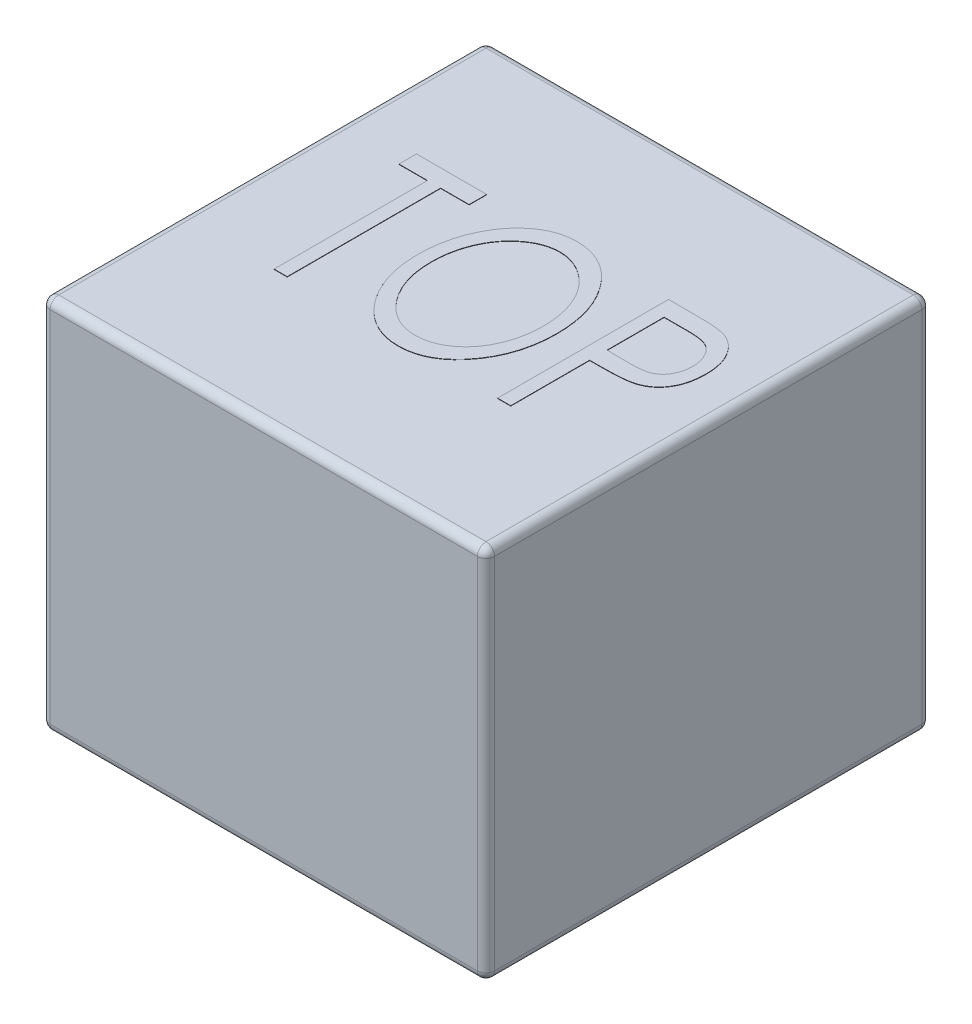
from build123d import *

# Parameters (mm, degrees)
SKETCH1_W           = 330.2
SKETCH1_H           = 330.2
BOSS_EXTRUDE1_DEPTH = 139.7
FILLET1_R           = 6.35
SHELL1_T            = 2.54
BOSS_EXTRUDE2_DEPTH = 0.254


with BuildPart() as part:
    # Sketch1 → Boss-Extrude1 (new, symmetric)
    with BuildSketch(Plane(origin=(0, 0, 0), x_dir=(1, 0, 0), z_dir=(0, 1, 0))):
        Rectangle(SKETCH1_W, SKETCH1_H)
    extrude(amount=BOSS_EXTRUDE1_DEPTH, both=True)

    # Fillet1
    fillet1_edges = [part.edges().sort_by_distance(p)[0] for p in [
        (-165.1, 139.7, 0),
        (0, 139.7, 165.1),
        (165.1, 139.7, 0),
        (0, -139.7, 165.1),
        (-165.1, -139.7, 0),
        (0, -139.7, -165.1),
        (165.1, -139.7, 0),
        (0, 139.7, -165.1),
        (165.1, 0, 165.1),
        (-165.1, 0, 165.1),
        (-165.1, 0, -165.1),
        (165.1, 0, -165.1),
    ]]
    fillet(fillet1_edges, radius=FILLET1_R)

    # Shell1 (no face opened: a closed hollow body)
    add(offset(amount=-SHELL1_T, mode=Mode.PRIVATE), mode=Mode.SUBTRACT)

    # Sketch2 → Boss-Extrude2 (add)
    # profile 1 of 3: a face of its own
    with BuildSketch(Plane(origin=(0, 139.7, 0), x_dir=(1, 0, 0), z_dir=(0, 1, 0))):
        Polygon((-116.257747145, 51.608887449), (-116.257747145, 64.634528475), (-64.155183043, 64.634528475), (-64.155183043, 51.608887449), (-85.321849709, 51.608887449), (-85.321849709, -62.365471525), (-95.091080479, -62.365471525), (-95.091080479, 51.608887449), align=None)
    # profile 2 of 3: a face of its own
    with BuildSketch(Plane(origin=(0, 139.7, 0), x_dir=(1, 0, 0), z_dir=(0, 1, 0))):
        with BuildLine():
            add(Edge.make_bspline(
                [(-0.477098107, 67.890938731), (1.332510055, 67.831001939), (4.897803281, 67.712914366), (10.136290395, 66.814017504), (15.124267645, 65.252329908), (19.928231303, 63.184557967), (24.449626918, 60.404111996), (28.778353935, 57.093301664), (32.833628821, 53.120957478), (36.63736966, 48.630165299), (40.08915671, 43.700269005), (43.145834194, 38.457373487), (45.705701534, 32.923156609), (47.838427264, 27.117699207), (49.460436839, 21.026900279), (50.585727835, 14.650859003), (51.32989139, 8.012630984), (51.407796821, 3.485615096), (51.44738106, 1.185409885)],
                knots=[0, 0, 0, 0, 0.924077672, 1.820619477, 2.704345957, 3.588793985, 4.484676341, 5.408225969, 6.367020371, 7.378085712, 8.410352545, 9.437079119, 10.473843711, 11.520765135, 12.592473861, 13.688494999, 14.825509789, 16, 16, 16, 16], degree=3))
            add(Edge.make_bspline(
                [(51.44738106, 1.185409885), (51.407954053, -1.097878767), (51.330365892, -5.591148362), (50.583237504, -12.186533678), (49.461812507, -18.529522501), (47.829989025, -24.608594101), (45.70796732, -30.413361342), (43.162251361, -35.974454308), (40.123400758, -41.249662075), (36.660075969, -46.197949702), (32.889947195, -50.728567364), (28.848577637, -54.697801904), (24.625210828, -58.095245156), (20.153306075, -60.831347903), (15.503557703, -63.008113829), (10.619014647, -64.494563567), (5.547651853, -65.455003315), (2.088323871, -65.565793262), (0.337004457, -65.621881782)],
                knots=[0, 0, 0, 0, 1.174734241, 2.311752237, 3.411847821, 4.48752463, 5.546540565, 6.589387645, 7.631512928, 8.675236458, 9.694545695, 10.660582558, 11.586248185, 12.47779178, 13.352673572, 14.221009544, 15.099368277, 16, 16, 16, 16], degree=3))
            add(Edge.make_bspline(
                [(0.337004457, -65.621881782), (-1.439783997, -65.566396642), (-4.941332781, -65.457051086), (-10.079102678, -64.491262776), (-15.012622144, -63.013653866), (-19.719173109, -60.856361968), (-24.217305685, -58.125216581), (-28.488841703, -54.752412203), (-32.535681302, -50.779442163), (-36.345805605, -46.285129032), (-39.795197951, -41.3541881), (-42.853127874, -36.12418546), (-45.377521475, -30.603796006), (-47.513881659, -24.864916686), (-49.14367975, -18.860756623), (-50.263437944, -12.602283923), (-51.012921852, -6.100278698), (-51.090242755, -1.674580458), (-51.129542017, 0.574832962)],
                knots=[0, 0, 0, 0, 0.916029328, 1.805235379, 2.688326709, 3.567593798, 4.468872984, 5.39761654, 6.369240692, 7.39061962, 8.433416311, 9.470616228, 10.512145238, 11.561531085, 12.627274475, 13.717256431, 14.839768611, 16, 16, 16, 16], degree=3))
            add(Edge.make_bspline(
                [(-51.129542017, 0.574832962), (-51.112594533, 2.084976877), (-51.078943502, 5.08352798), (-50.729638223, 9.540114978), (-50.201300449, 13.921247255), (-49.46309512, 18.217560919), (-48.527482157, 22.433540585), (-47.344863507, 26.555174764), (-45.985485953, 30.606514692), (-44.370640875, 34.536371478), (-42.616555322, 38.333944482), (-40.666255677, 41.922724883), (-38.622579881, 45.327461103), (-36.367006495, 48.484036352), (-33.975847521, 51.445253654), (-31.424729083, 54.197460015), (-28.732508159, 56.752129764), (-25.877474914, 59.052921019), (-22.949870851, 61.153331474), (-19.901899605, 62.923332923), (-16.81931378, 64.472259492), (-13.658498049, 65.714998623), (-10.443182, 66.692354686), (-7.172238037, 67.36634087), (-3.848739189, 67.833682212), (-1.606599712, 67.871757766), (-0.477098107, 67.890938731)],
                knots=[0, 0, 0, 0, 1.165548892, 2.314321092, 3.448658809, 4.571166437, 5.678142732, 6.780580233, 7.879845021, 8.975145667, 10.058763506, 11.107348894, 12.126777312, 13.122170764, 14.099577622, 15.063118597, 16.017094101, 16.961792914, 17.891746868, 18.795549715, 19.679698158, 20.552529034, 21.414067769, 22.270442689, 23.128717112, 24, 24, 24, 24], degree=3))
        make_face()
        with BuildLine():
            add(Edge.make_bspline(
                [(-0.04460612, 54.865297705), (-0.944875395, 54.850426102), (-2.74417294, 54.820703395), (-5.421110229, 54.433339757), (-8.070043085, 53.885959786), (-10.68192885, 53.100145723), (-13.232909748, 52.026384804), (-15.779487025, 50.795609956), (-18.278279844, 49.310548983), (-20.705445476, 47.602311557), (-23.073971928, 45.733003247), (-25.306567069, 43.663362962), (-27.425113092, 41.4552666), (-29.385586858, 39.074237496), (-31.220553747, 36.550958701), (-32.932164472, 33.868562799), (-34.507700795, 31.023945604), (-35.921345116, 28.027343499), (-37.194408463, 24.919123721), (-38.319360269, 21.712847737), (-39.25786253, 18.407024955), (-40.013301918, 15.015364183), (-40.635149249, 11.545794), (-41.059244738, 7.98666783), (-41.32370388, 4.335659268), (-41.348006092, 1.872770695), (-41.360311248, 0.625714372)],
                knots=[0, 0, 0, 0, 0.858142747, 1.715102558, 2.575073736, 3.437514735, 4.31186347, 5.212756088, 6.134013882, 7.081088492, 8.042565498, 9.010149336, 9.982893837, 10.959666839, 11.949981133, 12.957623844, 13.993261068, 15.049918441, 16.11656253, 17.196257349, 18.289715237, 19.392708064, 20.509938589, 21.650847962, 22.81053291, 24, 24, 24, 24], degree=3))
            add(Edge.make_bspline(
                [(-41.360311248, 0.625714372), (-41.332327635, -1.20782087), (-41.277375516, -4.808379655), (-40.661048314, -10.087092383), (-39.735705302, -15.152116147), (-38.406733447, -20.003121773), (-36.706868127, -24.647013292), (-34.60718036, -29.058736289), (-32.157445564, -33.268100739), (-29.327462934, -37.187816053), (-26.256721189, -40.781463974), (-22.990626338, -43.944440145), (-19.546012412, -46.599035546), (-15.949252574, -48.790605417), (-12.206182334, -50.513668405), (-8.284952554, -51.704086911), (-4.22242131, -52.482669997), (-1.447461601, -52.558105187), (-0.04460612, -52.596240756)],
                knots=[0, 0, 0, 0, 1.177444537, 2.312177139, 3.40960841, 4.482848825, 5.539490554, 6.582560744, 7.617904436, 8.664199621, 9.684176649, 10.651348494, 11.579811393, 12.472147848, 13.352309381, 14.219132689, 15.099698832, 16, 16, 16, 16], degree=3))
            add(Edge.make_bspline(
                [(-0.04460612, -52.596240756), (0.897689816, -52.578799709), (2.771256709, -52.544121678), (5.554015987, -52.200160879), (8.286516952, -51.643787722), (10.961787785, -50.844822853), (13.582707322, -49.855153064), (16.157983134, -48.650089004), (18.658952711, -47.198004143), (21.108488202, -45.541664529), (23.456224393, -43.689121079), (25.709838398, -41.684774816), (27.791213421, -39.481444), (29.755176793, -37.137613211), (31.595197326, -34.633906616), (33.297375664, -31.966741106), (34.852092016, -29.124159188), (36.272505494, -26.13465009), (37.528995589, -23.01149637), (38.669406118, -19.812666491), (39.561026004, -16.503296308), (40.375809522, -13.1353221), (40.938646844, -9.662809361), (41.382286755, -6.11704209), (41.639748187, -2.481915415), (41.665270753, -0.027652375), (41.678150291, 1.21085059)],
                knots=[0, 0, 0, 0, 0.896597927, 1.782705547, 2.664500824, 3.548252163, 4.437296353, 5.329230919, 6.25137377, 7.187229144, 8.141596259, 9.096202311, 10.055404798, 11.023835637, 12.00546529, 13.01090224, 14.033305449, 15.087649765, 16.159432575, 17.236763908, 18.317868849, 19.42025149, 20.533661908, 21.664060857, 22.821207218, 24, 24, 24, 24], degree=3))
            add(Edge.make_bspline(
                [(41.678150291, 1.21085059), (41.665260953, 2.440873428), (41.639720399, 4.878195233), (41.382443897, 8.487961243), (40.938185663, 12.008160519), (40.378878502, 15.44767056), (39.560840654, 18.772582606), (38.669263682, 22.031324831), (37.529131479, 25.179357133), (36.271409471, 28.251110471), (34.850728938, 31.202939512), (33.26895972, 34.001073004), (31.563176967, 36.652564311), (29.729713064, 39.159013382), (27.740597452, 41.505811948), (25.599739604, 43.691441313), (23.331561765, 45.731683681), (20.945058427, 47.612323099), (18.471480714, 49.30303869), (15.944838693, 50.796434779), (13.366214132, 52.032268507), (10.769855592, 53.100316607), (8.115230495, 53.882243967), (5.425518978, 54.436552749), (2.705531067, 54.820215288), (0.872564681, 54.850262718), (-0.04460612, 54.865297705)],
                knots=[0, 0, 0, 0, 1.175746054, 2.329770965, 3.456974185, 4.567169911, 5.658498816, 6.728634852, 7.795295362, 8.856674807, 9.90091875, 10.924568154, 11.927495013, 12.913337012, 13.891146488, 14.865724416, 15.835875264, 16.80572122, 17.768118354, 18.69828985, 19.608354684, 20.499556212, 21.3793278, 22.249031646, 23.123858975, 24, 24, 24, 24], degree=3))
        make_face(mode=Mode.SUBTRACT)
    # profile 3 of 3: a face of its own
    with BuildSketch(Plane(origin=(0, 139.7, 0), x_dir=(1, 0, 0), z_dir=(0, 1, 0))):
        with BuildLine():
            Line((70.985842598, 64.634528475), (90.702389073, 64.634528475))
            add(Edge.make_bspline(
                [(90.702389073, 64.634528475), (92.059321082, 64.632692833), (94.654893975, 64.629181572), (98.378054752, 64.519480217), (101.762619585, 64.373027201), (104.799260681, 64.171530278), (107.492217004, 63.932586473), (109.831683061, 63.592176416), (111.847055149, 63.245545821), (113.050200832, 62.889079884), (113.599023688, 62.72647559)],
                knots=[0, 0, 0, 0, 1.413289242, 2.703374391, 3.879342949, 4.941642004, 5.873291596, 6.693989754, 7.404254793, 8, 8, 8, 8], degree=3))
            add(Edge.make_bspline(
                [(113.599023688, 62.72647559), (114.300293426, 62.486721919), (115.687676063, 62.012396475), (117.6628722, 61.043861239), (119.549530649, 59.929945598), (121.338294313, 58.625739431), (123.021113822, 57.133316591), (124.630947308, 55.490551173), (126.103377585, 53.632170058), (127.502114126, 51.635249908), (128.772505526, 49.480529825), (129.877259585, 47.176124135), (130.773525562, 44.732394011), (131.561205975, 42.165051992), (132.121255706, 39.453625916), (132.565883992, 36.61100702), (132.820375971, 33.635486561), (132.845058568, 31.604479153), (132.85763747, 30.569424308)],
                knots=[0, 0, 0, 0, 0.884746594, 1.750370786, 2.622729615, 3.500310264, 4.390609716, 5.30783377, 6.244661446, 7.220040901, 8.219286538, 9.229974682, 10.268866035, 11.326756505, 12.435726026, 13.573575987, 14.763430443, 16, 16, 16, 16], degree=3))
            add(Edge.make_bspline(
                [(132.85763747, 30.569424308), (132.846407721, 29.525698835), (132.824460258, 27.48583786), (132.552724293, 24.497292763), (132.164524502, 21.646719818), (131.568076148, 18.93866878), (130.838079134, 16.369090553), (129.945193178, 13.933095293), (128.88257636, 11.637895483), (127.626765678, 9.505659284), (126.252362438, 7.513253363), (124.754489535, 5.675732778), (123.119340905, 4.015085826), (121.35853652, 2.528900898), (119.462878977, 1.239201127), (117.469488528, 0.071105377), (115.329504218, -0.886313592), (113.840492947, -1.403399644), (113.090209585, -1.663949089)],
                knots=[0, 0, 0, 0, 1.230348438, 2.404597596, 3.535952481, 4.620603023, 5.671397407, 6.683805958, 7.676968664, 8.649426021, 9.598095933, 10.528942615, 11.441124898, 12.342499997, 13.24120863, 14.141695784, 15.06363722, 16, 16, 16, 16], degree=3))
            add(Edge.make_bspline(
                [(113.090209585, -1.663949089), (112.464483169, -1.832735457), (111.104701879, -2.199529216), (108.860130239, -2.617915435), (106.253556641, -2.971134153), (103.28143251, -3.235989777), (99.939495941, -3.463825698), (96.23314682, -3.642570272), (92.161551186, -3.742290283), (89.328645847, -3.747416661), (87.853030098, -3.75008691)],
                knots=[0, 0, 0, 0, 0.612409215, 1.330841357, 2.156118473, 3.098102871, 4.150647915, 5.322299054, 6.605227774, 8, 8, 8, 8], degree=3))
            Line((87.853030098, -3.75008691), (80.755073367, -3.75008691))
            Line((80.755073367, -3.75008691), (80.755073367, -62.365471525))
            Line((80.755073367, -62.365471525), (70.985842598, -62.365471525))
            Line((70.985842598, -62.365471525), (70.985842598, 64.634528475))
        make_face()
        with BuildLine():
            Line((80.755073367, 51.608887449), (80.755073367, 9.275554116))
            Line((80.755073367, 9.275554116), (97.749464393, 8.995706359))
            add(Edge.make_bspline(
                [(97.749464393, 8.995706359), (98.580798557, 8.995002481), (100.185209995, 8.99364405), (102.50868425, 9.140568612), (104.657354894, 9.301689497), (106.636450444, 9.555593393), (108.4332136, 9.892016493), (110.075714301, 10.250794508), (111.522416904, 10.745586743), (113.234113158, 11.447114194), (115.13873406, 12.605618836), (117.189941376, 14.32022858), (118.911332546, 16.455273227), (120.421159693, 18.863574324), (121.587536543, 21.546343096), (122.473723406, 24.400536724), (122.981492318, 27.41368931), (123.052426278, 29.473651267), (123.088406701, 30.518542898)],
                knots=[0, 0, 0, 0, 1.042081371, 2.011137451, 2.917996092, 3.743607318, 4.511095698, 5.210044043, 5.848905295, 6.425539579, 7.526959198, 8.628378818, 9.761072847, 10.950155818, 12.183071426, 13.417453374, 14.690033403, 16, 16, 16, 16], degree=3))
            add(Edge.make_bspline(
                [(123.088406701, 30.518542898), (123.052289547, 31.538093146), (122.980804144, 33.556052831), (122.469344347, 36.517045747), (121.590609207, 39.340553161), (120.408792864, 41.991692996), (118.955683979, 44.393961352), (117.257677595, 46.467066007), (115.341821323, 48.178846535), (113.514055216, 49.258935885), (111.898651854, 49.943790685), (110.510703172, 50.391479704), (108.946519326, 50.774600366), (107.202031308, 51.069451156), (105.285085032, 51.325609414), (103.179568495, 51.499833344), (100.905148163, 51.600843379), (99.326898496, 51.606149857), (98.512685547, 51.608887449)],
                knots=[0, 0, 0, 0, 1.311348819, 2.595506256, 3.851552363, 5.106555753, 6.32083189, 7.452254181, 8.542153451, 9.608595853, 10.16582827, 10.797158969, 11.48245446, 12.235753575, 13.072011464, 13.969832696, 14.952644476, 16, 16, 16, 16], degree=3))
            Line((98.512685547, 51.608887449), (80.755073367, 51.608887449))
        make_face(mode=Mode.SUBTRACT)
    extrude(amount=BOSS_EXTRUDE2_DEPTH)


solid = part.part
